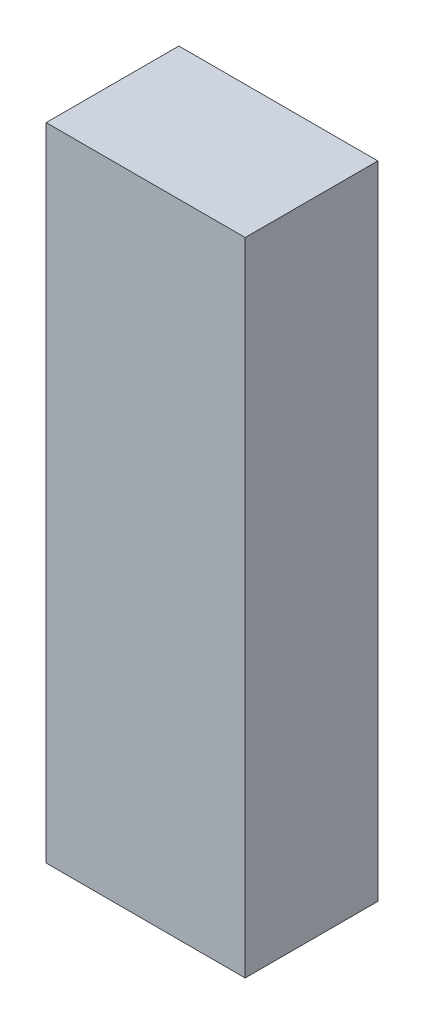
from build123d import *

# Parameters (mm, degrees)
SKETCH_1_W      = 45
SKETCH_1_H      = 30
EXTRUDE_1_DEPTH = 145


with BuildPart() as part:
    # 草图1 → 凸台-拉伸1 (new body)
    with BuildSketch(Plane(origin=(0, 0, 0), x_dir=(1, 0, 0), z_dir=(0, 1, 0))):
        Rectangle(SKETCH_1_W, SKETCH_1_H)
    extrude(amount=EXTRUDE_1_DEPTH)


solid = part.part
